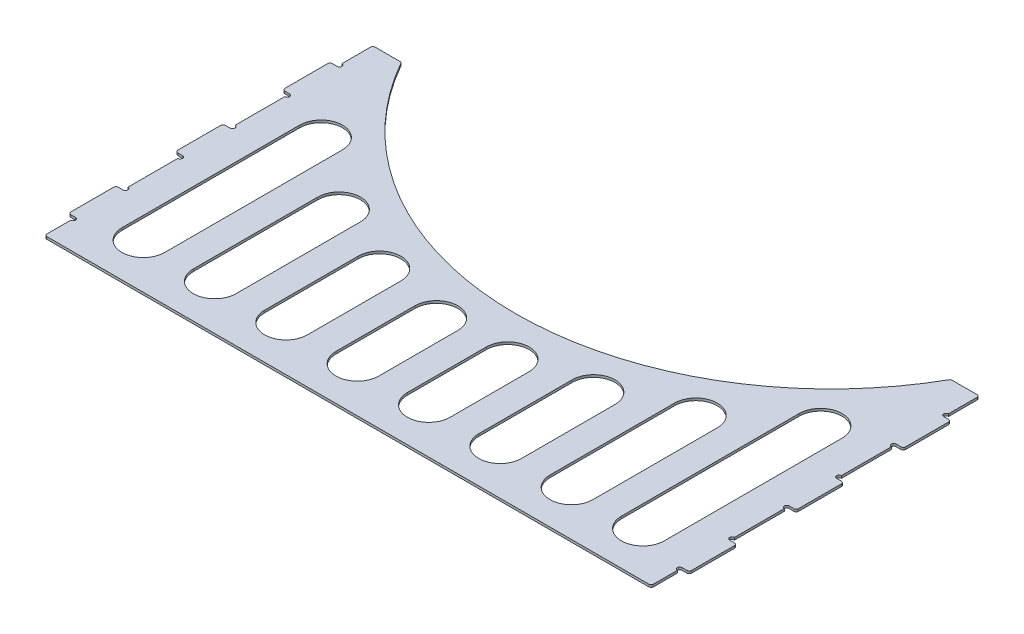
from build123d import *

# Parameters (mm, degrees)
SKETCH_1_W          = 255
SKETCH_1_H          = 138
EXTRUDE_1_DEPTH     = 1
CUT_EXTRUDE_1_DEPTH = 188.88626879
SKETCH_5_W          = 3
SKETCH_5_H          = 20
EXTRUDE_3_DEPTH     = 1
SKETCH_6_R          = 1
CUT_EXTRUDE_3_DEPTH = 190.934857254
CUT_EXTRUDE_5_DEPTH = 190.934857254
FILLET_1_R          = 1


with BuildPart() as part:
    # 草图1 → 凸台-拉伸1 (new body)
    with BuildSketch(Plane(origin=(0, 0, 0), x_dir=(1, 0, 0), z_dir=(0, 1, 0))):
        with Locations((0, -69)):
            Rectangle(SKETCH_1_W, SKETCH_1_H)
    extrude(amount=EXTRUDE_1_DEPTH)

    # 草图2 → 切除-拉伸1 (cut, through all)
    with BuildSketch(Plane(origin=(0, 1, 0), x_dir=(1, 0, 0), z_dir=(0, 1, 0))):
        with BuildLine():
            Line((-115.5, 0), (115.5, 0))
            ThreePointArc((115.5, 0), (0, -67.533957913), (-115.5, 0))
        make_face()
    extrude(amount=-CUT_EXTRUDE_1_DEPTH, mode=Mode.SUBTRACT)

    # 草图5 → 凸台-拉伸3 (add)
    with BuildSketch(Plane(origin=(0, 1, 0), x_dir=(1, 0, 0), z_dir=(0, 1, 0))):
        with Locations((-129, -25)):
            Rectangle(SKETCH_5_W, SKETCH_5_H)
        with Locations((-129, -70)):
            Rectangle(SKETCH_5_W, SKETCH_5_H)
        with Locations((129, -25)):
            Rectangle(SKETCH_5_W, SKETCH_5_H)
        with Locations((-129, -115)):
            Rectangle(SKETCH_5_W, SKETCH_5_H)
        with Locations((129, -115)):
            Rectangle(SKETCH_5_W, SKETCH_5_H)
        with Locations((129, -70)):
            Rectangle(SKETCH_5_W, SKETCH_5_H)
    extrude(amount=-EXTRUDE_3_DEPTH)

    # 草图6 → 切除-拉伸3 (cut, through all)
    with BuildSketch(Plane(origin=(0, 1, 0), x_dir=(1, 0, 0), z_dir=(0, 1, 0))):
        with Locations((-127.5, -14)):
            Circle(SKETCH_6_R)
        with Locations((-127.5, -36)):
            Circle(SKETCH_6_R)
        with Locations((127.5, -36)):
            Circle(SKETCH_6_R)
        with Locations((127.5, -14)):
            Circle(SKETCH_6_R)
        with Locations((-127.5, -59)):
            Circle(SKETCH_6_R)
        with Locations((-127.5, -81)):
            Circle(SKETCH_6_R)
        with Locations((-127.5, -104)):
            Circle(SKETCH_6_R)
        with Locations((-127.5, -126)):
            Circle(SKETCH_6_R)
        with Locations((127.5, -126)):
            Circle(SKETCH_6_R)
        with Locations((127.5, -104)):
            Circle(SKETCH_6_R)
        with Locations((127.5, -81)):
            Circle(SKETCH_6_R)
        with Locations((127.5, -59)):
            Circle(SKETCH_6_R)
    extrude(amount=-CUT_EXTRUDE_3_DEPTH, mode=Mode.SUBTRACT)

    # 草图7 → 切除-拉伸5 (cut, through all)
    with BuildSketch(Plane(origin=(0, 1, 0), x_dir=(1, 0, 0), z_dir=(0, 1, 0))):
        with BuildLine():
            Line((-96, -44.259051802), (-96, -119))
            ThreePointArc((-96, -119), (-105, -128), (-114, -119))
            Line((-114, -119), (-114, -44.259051802))
            ThreePointArc((-114, -44.259051802), (-105, -35.259051802), (-96, -44.259051802))
        make_face()
        with BuildLine():
            Line((-66, -66.672094237), (-66, -119))
            ThreePointArc((-66, -119), (-75, -128), (-84, -119))
            Line((-84, -119), (-84, -66.672094237))
            ThreePointArc((-84, -66.672094237), (-75, -57.672094237), (-66, -66.672094237))
        make_face()
        with BuildLine():
            Line((-36, -79.698100888), (-36, -119))
            ThreePointArc((-36, -119), (-45, -128), (-54, -119))
            Line((-54, -119), (-54, -79.698100888))
            ThreePointArc((-54, -79.698100888), (-45, -70.698100888), (-36, -79.698100888))
        make_face()
        with BuildLine():
            Line((-6, -85.789722464), (-6, -119))
            ThreePointArc((-6, -119), (-15, -128), (-24, -119))
            Line((-24, -119), (-24, -85.789722464))
            ThreePointArc((-24, -85.789722464), (-15, -76.789722464), (-6, -85.789722464))
        make_face()
        with BuildLine():
            Line((6, -85.789722464), (6, -119))
            ThreePointArc((6, -119), (15, -128), (24, -119))
            Line((24, -119), (24, -85.789722464))
            ThreePointArc((24, -85.789722464), (15, -76.789722464), (6, -85.789722464))
        make_face()
        with BuildLine():
            Line((36, -79.698100888), (36, -119))
            ThreePointArc((36, -119), (45, -128), (54, -119))
            Line((54, -119), (54, -79.698100888))
            ThreePointArc((54, -79.698100888), (45, -70.698100888), (36, -79.698100888))
        make_face()
        with BuildLine():
            Line((66, -66.672094237), (66, -119))
            ThreePointArc((66, -119), (75, -128), (84, -119))
            Line((84, -119), (84, -66.672094237))
            ThreePointArc((84, -66.672094237), (75, -57.672094237), (66, -66.672094237))
        make_face()
        with BuildLine():
            Line((96, -44.259051802), (96, -119))
            ThreePointArc((96, -119), (105, -128), (114, -119))
            Line((114, -119), (114, -44.259051802))
            ThreePointArc((114, -44.259051802), (105, -35.259051802), (96, -44.259051802))
        make_face()
    extrude(amount=-CUT_EXTRUDE_5_DEPTH, mode=Mode.SUBTRACT)

    # 圆角1
    fillet_1_edges = [part.edges().sort_by_distance(p)[0] for p in [
        (-127.5, 0.5, 58),
        (115.5, 0.5, 0),
        (-115.5, 0.5, 0),
        (-130.5, 0.5, 35),
        (-130.5, 0.5, 15),
        (130.5, 0.5, 15),
        (130.5, 0.5, 35),
        (-130.5, 0.5, 80),
        (-130.5, 0.5, 60),
        (-130.5, 0.5, 125),
        (-130.5, 0.5, 105),
        (130.5, 0.5, 105),
        (130.5, 0.5, 125),
        (-127.5, 0.5, 0),
        (127.5, 0.5, 0),
        (127.5, 0.5, 138),
        (-127.5, 0.5, 138),
        (130.5, 0.5, 60),
        (130.5, 0.5, 80),
    ]]
    fillet(fillet_1_edges, radius=FILLET_1_R)


solid = part.part
